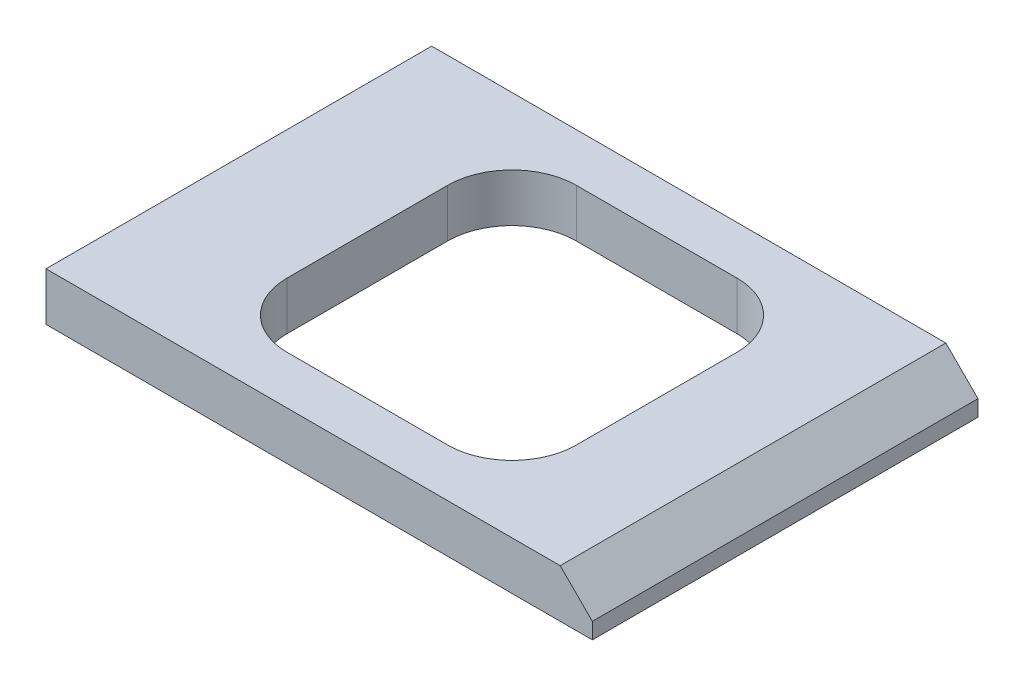
from build123d import *

# Parameters (mm, degrees)
SKETCH1_W               = 53.975
SKETCH1_H               = 38.1
BOSS_EXTRUDE1_DEPTH     = 2.38125
CHAMFER1_SIZE           = 3.175
CUT_EXTRUDE1_DEPTH      = 34.375276216
CUT_EXTRUDE1_DEPTH_BACK = 34.375276216
SKETCH4_W               = 28.575
SKETCH4_H               = 28.575
FILLET1_R               = 6.35


with BuildPart() as part:
    # Sketch1 → Boss-Extrude1 (new, symmetric)
    with BuildSketch(Plane(origin=(0, 0, 0), x_dir=(1, 0, 0), z_dir=(0, 1, 0))):
        Rectangle(SKETCH1_W, SKETCH1_H)
    extrude(amount=BOSS_EXTRUDE1_DEPTH, both=True)

    # Chamfer1
    chamfer1_edges = [part.edges().sort_by_distance(p)[0] for p in [
        (26.9875, 2.38125, 0),
    ]]
    chamfer(chamfer1_edges, length=CHAMFER1_SIZE)

    # Sketch4 → Cut-Extrude1 (cut, two sides: drawn at the far end of the back side and taken through both)
    with BuildSketch(Plane(origin=(0, 2.38125, 0), x_dir=(1, 0, 0), z_dir=(0, 1, 0)).offset(-CUT_EXTRUDE1_DEPTH_BACK)):
        Rectangle(SKETCH4_W, SKETCH4_H)
    extrude(amount=CUT_EXTRUDE1_DEPTH + CUT_EXTRUDE1_DEPTH_BACK, mode=Mode.SUBTRACT)

    # Fillet1
    fillet1_edges = [part.edges().sort_by_distance(p)[0] for p in [
        (-14.2875, 0, 14.2875),
        (-14.2875, 0, -14.2875),
        (14.2875, 0, -14.2875),
        (14.2875, 0, 14.2875),
    ]]
    fillet(fillet1_edges, radius=FILLET1_R)


solid = part.part
